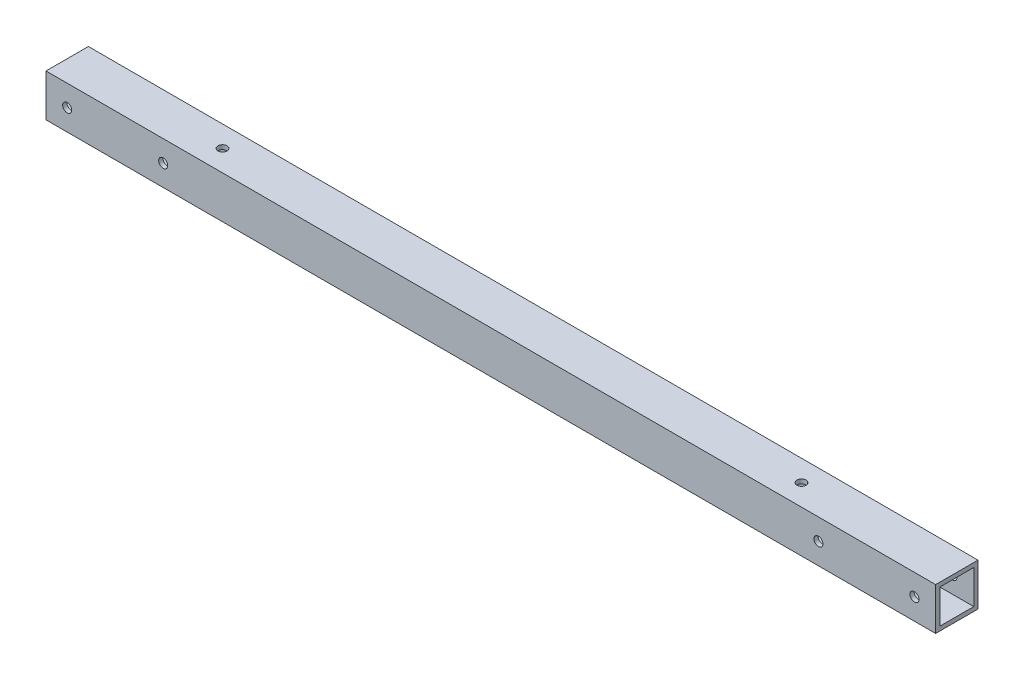
from build123d import *

# Parameters (mm, degrees)
SKETCH_2_W          = 315
SKETCH_2_H          = 15
SKETCH_2_R          = 1.6
EXTRUDE_1_DEPTH     = 15
SKETCH_3_W          = 12
SKETCH_3_H          = 12
CUT_EXTRUDE_1_DEPTH = 316.713477698
SKETCH_4_R          = 1.6
CUT_EXTRUDE_2_DEPTH = 316.713477698


with BuildPart() as part:
    # ｽｹｯﾁ2 → ﾎﾞｽ - 押し出し1 (new body)
    with BuildSketch(Plane.XY):
        with Locations((157.5, -7.5)):
            Rectangle(SKETCH_2_W, SKETCH_2_H)
        with Locations((7.5, -7.5)):
            Circle(SKETCH_2_R, mode=Mode.SUBTRACT)
        with Locations((41.5, -7.5)):
            Circle(SKETCH_2_R, mode=Mode.SUBTRACT)
        with Locations((273.5, -7.5)):
            Circle(SKETCH_2_R, mode=Mode.SUBTRACT)
        with Locations((307.5, -7.5)):
            Circle(SKETCH_2_R, mode=Mode.SUBTRACT)
    extrude(amount=EXTRUDE_1_DEPTH)

    # ｽｹｯﾁ3 → ｶｯﾄ - 押し出し1 (cut, through all)
    with BuildSketch(Plane(origin=(315, 0, 0), x_dir=(0, 0, -1), z_dir=(1, 0, 0))):
        with Locations((-7.5, -7.5)):
            Rectangle(SKETCH_3_W, SKETCH_3_H)
    extrude(amount=-CUT_EXTRUDE_1_DEPTH, mode=Mode.SUBTRACT)

    # ｽｹｯﾁ4 → ｶｯﾄ - 押し出し2 (cut, through all)
    with BuildSketch(Plane(origin=(0, 0, 0), x_dir=(1, 0, 0), z_dir=(0, 1, 0))):
        with Locations(Location((55, -7.5, 0), (0, 0, 270))):
            Circle(SKETCH_4_R)
        with Locations(Location((260, -7.5, 0), (0, 0, 270))):
            Circle(SKETCH_4_R)
    extrude(amount=-CUT_EXTRUDE_2_DEPTH, mode=Mode.SUBTRACT)


solid = part.part
